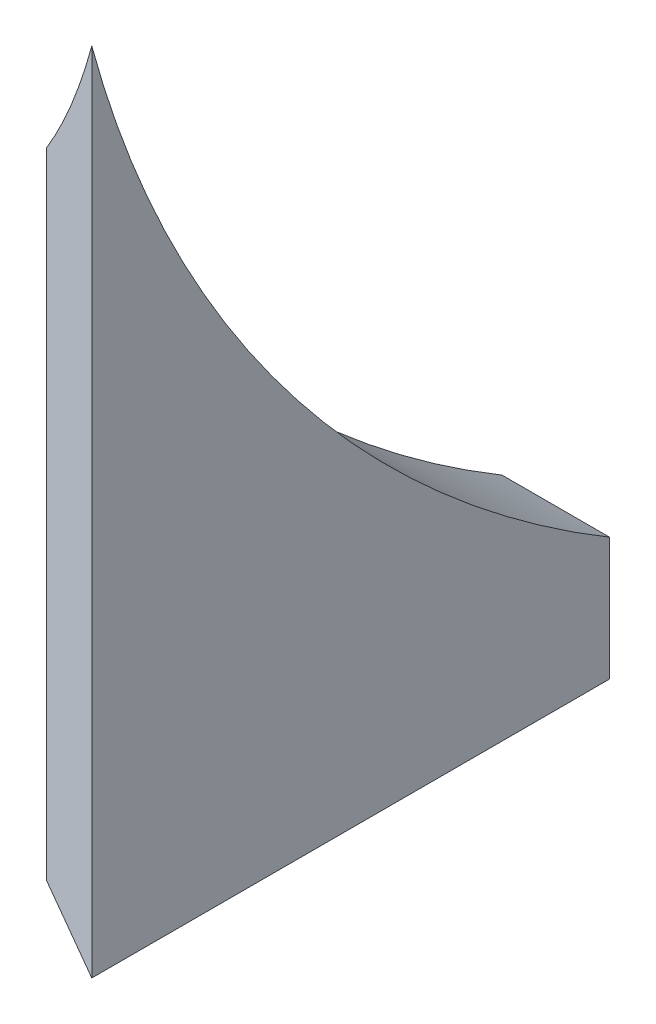
from build123d import *

# Parameters (mm, degrees)
BOSS_EXTRUDE1_DEPTH = 4
SKETCH2_W           = 10.75
SKETCH2_H           = 20.327264221
CUT_EXTRUDE1_DEPTH  = 4
CUT_EXTRUDE2_DEPTH  = 50.8


with BuildPart() as part:
    # Sketch1 → Boss-Extrude1 (new body)
    with BuildSketch(Plane(origin=(0, 0, 0), x_dir=(0, 0, -1), z_dir=(1, 0, 0))):
        with BuildLine():
            Line((-11.867139326, 22.331980986), (-11.867139326, -7.668019014))
            Line((-11.867139326, -7.668019014), (18.132860674, -7.668019014))
            ThreePointArc((18.132860674, -7.668019014), (-0.870157122, 3.328963189), (-11.867139326, 22.331980986))
        make_face()
    extrude(amount=BOSS_EXTRUDE1_DEPTH)

    # Sketch2 → Cut-Extrude1 (cut)
    with BuildSketch(Plane(origin=(4, 0, 0), x_dir=(0, 0, -1), z_dir=(1, 0, 0))):
        with Locations((12.757860674, 2.495613097)):
            Rectangle(SKETCH2_W, SKETCH2_H)
    extrude(amount=-CUT_EXTRUDE1_DEPTH, mode=Mode.SUBTRACT)

    # Sketch4 → Cut-Extrude2 (cut)
    with BuildSketch(Plane.XZ.offset(7.668019014)):
        Polygon((0, 11.867139326), (0, 9.557738249), (4, 11.867139326), align=None)
    extrude(amount=-CUT_EXTRUDE2_DEPTH, mode=Mode.SUBTRACT)


solid = part.part
